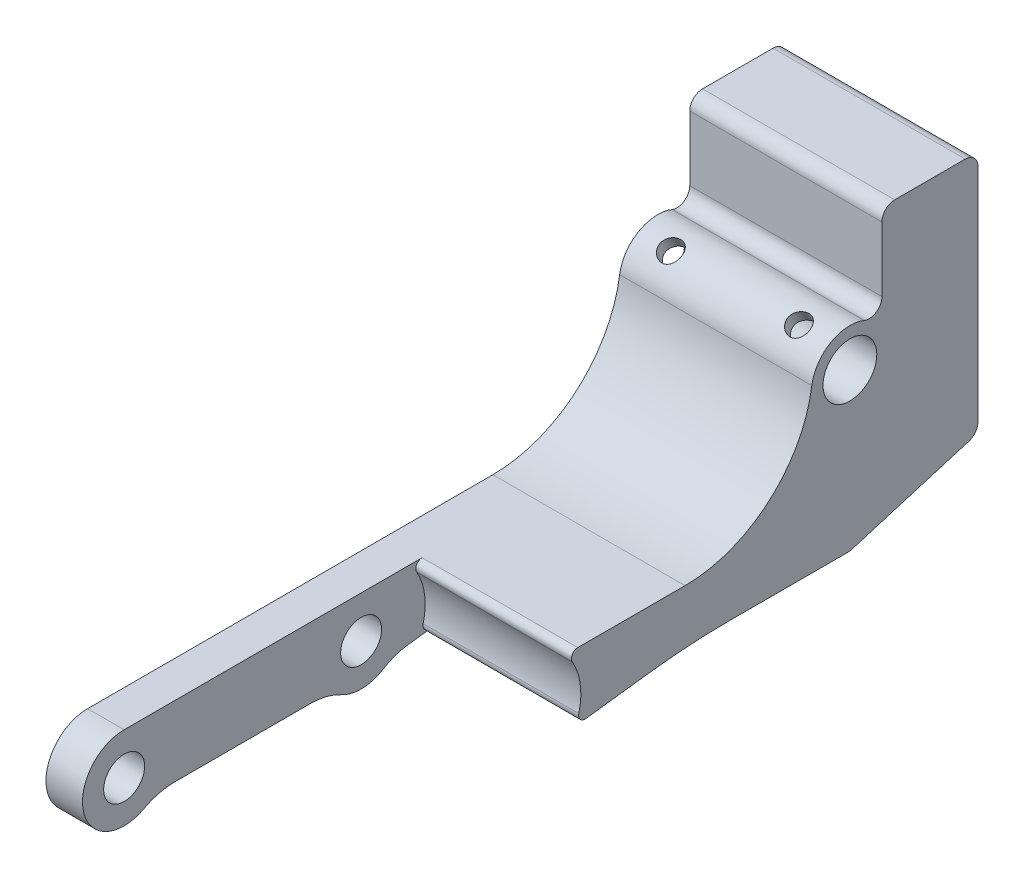
from build123d import *
from build123d.topology import SkipClean

# Parameters (mm, degrees)
SKETCH_1_R               = 4.2
SKETCH_1_R_2             = 3.2
EXTRUDE_1_DEPTH          = 30
CUT_EXTRUDE_1_DEPTH      = 125.586877319
CUT_EXTRUDE_1_DEPTH_BACK = 125.586877319
SKETCH_2_R               = 5
SKETCH_4_R               = 8
CUT_EXTRUDE_3_DEPTH      = 24.3
CUT_EXTRUDE_4_DEPTH      = 24.3
CUT_EXTRUDE_5_REACH      = 105.181
CUT_EXTRUDE_5_END_RADIUS = 4.2
SKETCH_7_R               = 1.7
FILLET_1_R               = 2
FILLET_2_R               = 100
FILLET_4_R               = 2
FILLET_5_R               = 1
FILLET_6_R               = 10


with BuildPart() as part:
    # ｽｹｯﾁ1 → ﾎﾞｽ - 押し出し1 (new body)
    with BuildSketch(Plane(origin=(0, 0, 0), x_dir=(0, 0, -1), z_dir=(1, 0, 0))):
        with BuildLine():
            Line((0, 0), (0, -38))
            Line((0, -38), (-20, -44))
            Line((-20, -44), (-45, -44))
            Line((-45, -44), (-67.30958424, -46.8))
            ThreePointArc((-67.30958424, -46.8), (-72, -48.8), (-76.69041576, -46.8))
            Line((-76.69041576, -46.8), (-104.30958424, -46.8))
            ThreePointArc((-104.30958424, -46.8), (-114.979130372, -44.849509757), (-109, -35.8))
            Line((-109, -35.8), (-73.332546795, -35.8))
            Line((-73.332546795, -35.8), (-72, -35.8))
            Line((-72, -35.8), (-45.735384202, -35.8))
            ThreePointArc((-45.735384202, -35.8), (-32.638114962, -30.91494421), (-25.938934816, -18.646153846))
            ThreePointArc((-25.938934816, -18.646153846), (-24.759789788, -15.847001072), (-22.360864108, -13.983994139))
            ThreePointArc((-22.360864108, -13.983994139), (-18.282275098, -13.751137403), (-15, -16.18337521))
            Line((-15, -16.18337521), (-15, 0))
            Line((-15, 0), (0, 0))
        make_face()
        with Locations((-20, -19.5)):
            Circle(SKETCH_1_R, mode=Mode.SUBTRACT)
        with Locations((-109, -42.3)):
            Circle(SKETCH_1_R_2, mode=Mode.SUBTRACT)
        with Locations((-72, -42.3)):
            Circle(SKETCH_1_R_2, mode=Mode.SUBTRACT)
    extrude(amount=EXTRUDE_1_DEPTH)

    # ｽｹｯﾁ2 → ｶｯﾄ - 押し出し1 (cut, two sides: drawn at the far end of the back side and taken through both)
    with BuildSketch(Plane(origin=(0, -35.8, 0), x_dir=(1, 0, 0), z_dir=(0, 1, 0)).offset(-CUT_EXTRUDE_1_DEPTH_BACK)):
        with Locations(Location((15, -83.6, 0), (0, 0, 270))):
            Circle(SKETCH_2_R)
    extrude(amount=CUT_EXTRUDE_1_DEPTH + CUT_EXTRUDE_1_DEPTH_BACK, mode=Mode.SUBTRACT)

    # ｽｹｯﾁ4 → ｶｯﾄ - 押し出し3 (cut)
    with BuildSketch(Plane(origin=(30, 0, 0), x_dir=(0, 0, -1), z_dir=(1, 0, 0))):
        with Locations((-72, -42.3)):
            Circle(SKETCH_4_R)
        with Locations((-109, -42.3)):
            Circle(SKETCH_4_R)
    extrude(amount=-CUT_EXTRUDE_3_DEPTH, mode=Mode.SUBTRACT)

    # ｽｹｯﾁ5 → ｶｯﾄ - 押し出し4 (cut)
    with BuildSketch(Plane(origin=(30, 0, 0), x_dir=(0, 0, -1), z_dir=(1, 0, 0))):
        with BuildLine():
            Line((-109, -32.3), (-72, -32.3))
            ThreePointArc((-72, -32.3), (-62, -42.3), (-72, -52.3))
            Line((-72, -52.3), (-109, -52.3))
            ThreePointArc((-109, -52.3), (-119, -42.3), (-109, -32.3))
        make_face()
    extrude(amount=-CUT_EXTRUDE_4_DEPTH, mode=Mode.SUBTRACT)

    # ｶｯﾄ - 押し出し5: up to this cylinder (the profile starts outside it)
    with SkipClean():  # the faces are left unmerged after this step: merging them gives an invalid solid
        cut_extrude_5_end = Plane(origin=(15, -19.5, 20), z_dir=(-1, 0, 0)) * Cylinder(CUT_EXTRUDE_5_END_RADIUS, 239.762, mode=Mode.PRIVATE)
        # ｽｹｯﾁ7 → ｶｯﾄ - 押し出し5 (cut, up to the surface)
        with BuildSketch(Plane(origin=(30, -14.303847577, 23), x_dir=(1, 0, 0), z_dir=(0, 0.866025403784436, 0.5000000000000043)), mode=Mode.PRIVATE) as cut_extrude_5_sk1:
            with Locations(Location((-5, 0, 0), (0, 0, 270))):
                Circle(SKETCH_7_R)
        cut_extrude_5_tool1 = extrude(cut_extrude_5_sk1.sketch, amount=-CUT_EXTRUDE_5_REACH, mode=Mode.PRIVATE) - cut_extrude_5_end
        add(cut_extrude_5_tool1.solids().sort_by_distance((25, -14.303848, 23))[0], mode=Mode.SUBTRACT)
        # ｽｹｯﾁ7 → ｶｯﾄ - 押し出し5 (cut, up to the surface)
        with BuildSketch(Plane(origin=(30, -14.303847577, 23), x_dir=(1, 0, 0), z_dir=(0, 0.866025403784436, 0.5000000000000043)), mode=Mode.PRIVATE) as cut_extrude_5_sk2:
            with Locations(Location((-25, 0, 0), (0, 0, 270))):
                Circle(SKETCH_7_R)
        cut_extrude_5_tool2 = extrude(cut_extrude_5_sk2.sketch, amount=-CUT_EXTRUDE_5_REACH, mode=Mode.PRIVATE) - cut_extrude_5_end
        add(cut_extrude_5_tool2.solids().sort_by_distance((5, -14.303848, 23))[0], mode=Mode.SUBTRACT)

    # ﾌｨﾚｯﾄ1
    fillet_1_edges = [part.edges().sort_by_distance(p)[0] for p in [
        (15, -16.18337521, 15),
    ]]
    fillet(fillet_1_edges, radius=FILLET_1_R)

    # ﾌｨﾚｯﾄ2
    fillet_2_edges = [part.edges().sort_by_distance(p)[0] for p in [
        (15, -44, 45),
    ]]
    fillet(fillet_2_edges, radius=FILLET_2_R)

    # ﾌｨﾚｯﾄ4
    fillet_4_edges = [part.edges().sort_by_distance(p)[0] for p in [
        (15, 0, 0),
        (15, -38, 0),
        (15, -44, 20),
        (15, 0, 15),
    ]]
    fillet(fillet_4_edges, radius=FILLET_4_R)

    # ﾌｨﾚｯﾄ5
    fillet_5_edges = [part.edges().sort_by_distance(p)[0] for p in [
        (17.85, -46.23485742, 62.80669281),
        (17.85, -35.8, 64.400657923),
    ]]
    fillet(fillet_5_edges, radius=FILLET_5_R)

    # ﾌｨﾚｯﾄ6
    fillet_6_edges = [part.edges().sort_by_distance(p)[0] for p in [
        (2.85, -46.8, 67.30958424),
        (2.85, -46.8, 76.69041576),
        (2.85, -46.8, 104.30958424),
    ]]
    fillet(fillet_6_edges, radius=FILLET_6_R)


solid = part.part
